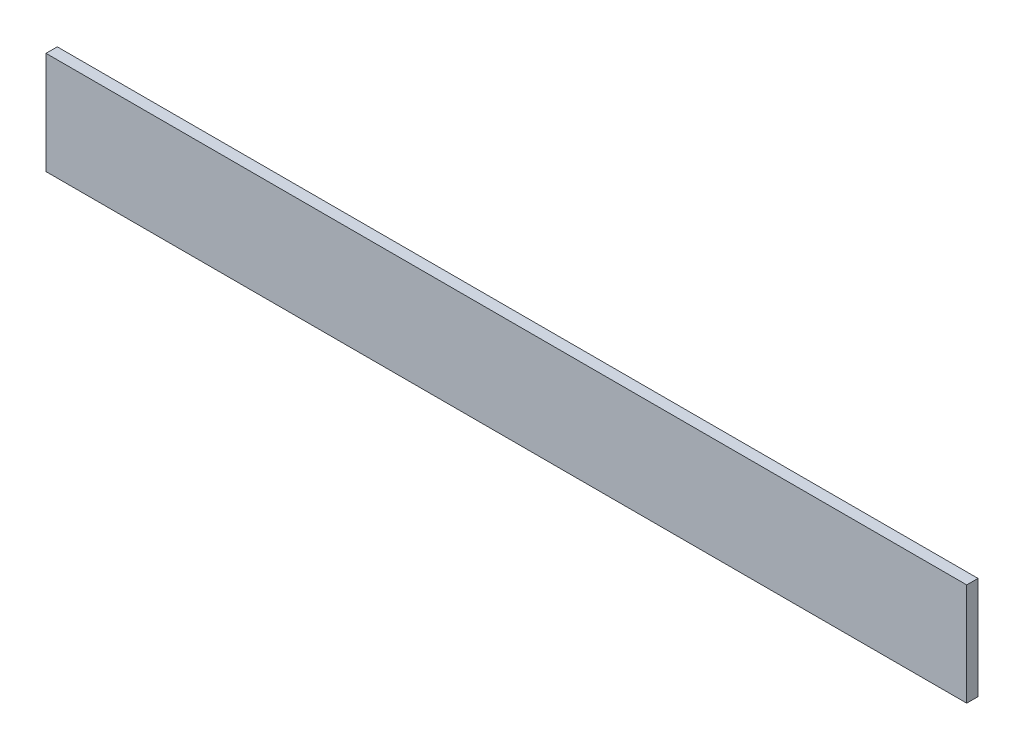
from build123d import *

# Parameters (mm, degrees)
SKETCH1_W           = 82.95
SKETCH1_H           = 9.23
BOSS_EXTRUDE1_DEPTH = 1.016


with BuildPart() as part:
    # Sketch1 → Boss-Extrude1 (new body)
    with BuildSketch(Plane.XY):
        with Locations((41.475, 4.615)):
            Rectangle(SKETCH1_W, SKETCH1_H)
    extrude(amount=BOSS_EXTRUDE1_DEPTH)


solid = part.part
